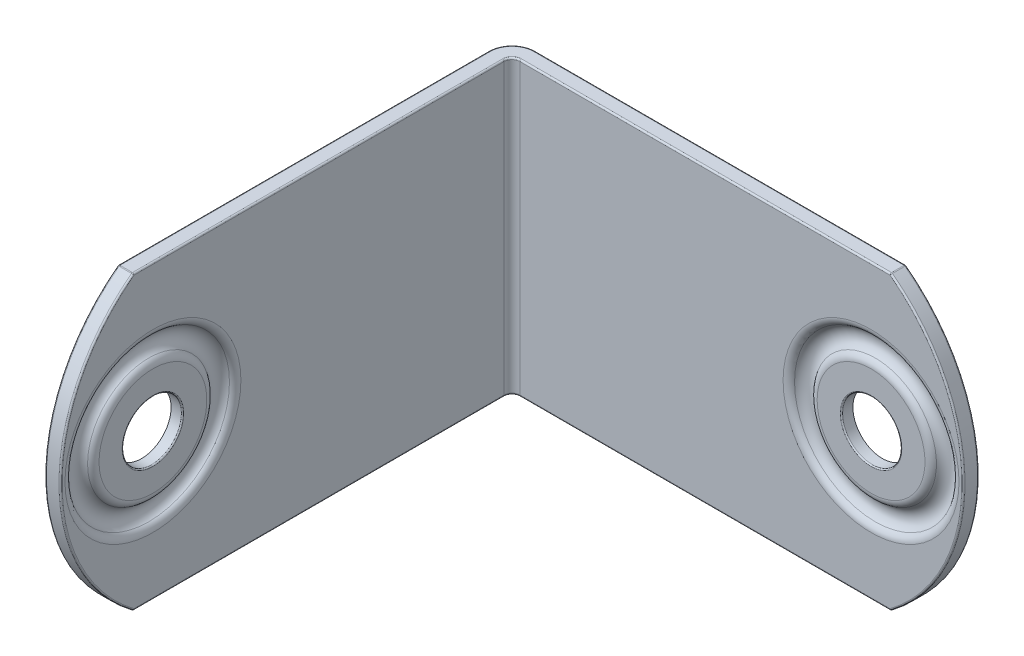
from build123d import *

# Parameters (mm, degrees)
BOSS_EXTRUDE1_START = 11.90625
BOSS_EXTRUDE1_DEPTH = 23.8125
SKETCH4_W           = 1.27
SKETCH4_H           = 2.413
SKETCH5_W           = 2.413
SKETCH5_H           = 1.27
CUT_EXTRUDE1_DEPTH  = 44.140586332
CUT_EXTRUDE2_DEPTH  = 44.140586332
FILLET1_R           = 0.127
FILLET2_R           = 0.09652


with BuildPart() as part:
    # Sketch3 → Boss-Extrude1 (new body)
    with BuildSketch(Plane(origin=(0, 0, 0), x_dir=(1, 0, 0), z_dir=(0, 1, 0)).offset(BOSS_EXTRUDE1_START)):
        with BuildLine():
            Line((-19.05, -19.05), (-17.78, -19.05))
            Line((-17.78, -19.05), (-17.78, 17.145))
            ThreePointArc((-17.78, 17.145), (-17.594012806, 17.594012806), (-17.145, 17.78))
            Line((-17.145, 17.78), (19.05, 17.78))
            Line((19.05, 17.78), (19.05, 19.05))
            Line((19.05, 19.05), (-17.145, 19.05))
            ThreePointArc((-17.145, 19.05), (-18.492038418, 18.492038418), (-19.05, 17.145))
            Line((-19.05, 17.145), (-19.05, -19.05))
        make_face()
    extrude(amount=-BOSS_EXTRUDE1_DEPTH)

    # Sketch4 → Cut-Revolve1 (revolve, cut)
    with BuildSketch(Plane(origin=(0, 0, 0), x_dir=(1, 0, 0), z_dir=(0, 1, 0)), mode=Mode.PRIVATE) as cut_revolve1_sk:
        with Locations((-18.415, -10.302875)):
            Rectangle(SKETCH4_W, SKETCH4_H)
    revolve(cut_revolve1_sk.sketch.rotate(Axis((-19.05, 0, 11.509375), (1, 0, 0)), 180), axis=Axis((-19.05, 0, 11.509375), (1, 0, 0)), mode=Mode.SUBTRACT)

    # Sketch5 → Cut-Revolve2 (revolve, cut)
    with BuildSketch(Plane(origin=(0, 0, 0), x_dir=(1, 0, 0), z_dir=(0, 1, 0)), mode=Mode.PRIVATE) as cut_revolve2_sk:
        with Locations((12.715875, 18.415)):
            Rectangle(SKETCH5_W, SKETCH5_H)
    revolve(cut_revolve2_sk.sketch.rotate(Axis((11.509375, 0, -19.05), (0, 0, 1)), 180), axis=Axis((11.509375, 0, -19.05), (0, 0, 1)), mode=Mode.SUBTRACT)

    # Sketch6 → Cut-Extrude1 (cut, through all)
    with BuildSketch(Plane(origin=(-17.78, 0, 0), x_dir=(0, 0, -1), z_dir=(1, 0, 0))):
        with BuildLine():
            ThreePointArc((-19.05, 0), (-17.478779679, 6.655796089), (-13.096875, 11.90625))
            Line((-13.096875, 11.90625), (-19.05, 11.90625))
            Line((-19.05, 11.90625), (-19.05, 0))
        make_face()
        with BuildLine():
            ThreePointArc((-13.096875, -11.90625), (-17.478779679, -6.655796089), (-19.05, 0))
            Line((-19.05, 0), (-19.05, -11.90625))
            Line((-19.05, -11.90625), (-13.096875, -11.90625))
        make_face()
    extrude(amount=-CUT_EXTRUDE1_DEPTH, mode=Mode.SUBTRACT)

    # Sketch7 → Cut-Extrude2 (cut, through all)
    with BuildSketch(Plane.XY.offset(-17.78)):
        with BuildLine():
            Line((19.05, 11.90625), (13.096875, 11.90625))
            ThreePointArc((13.096875, 11.90625), (17.478779679, 6.655796089), (19.05, 0))
            Line((19.05, 0), (19.05, 11.90625))
        make_face()
        with BuildLine():
            Line((19.05, -11.90625), (19.05, 0))
            ThreePointArc((19.05, 0), (17.478779679, -6.655796089), (13.096875, -11.90625))
            Line((13.096875, -11.90625), (19.05, -11.90625))
        make_face()
    extrude(amount=-CUT_EXTRUDE2_DEPTH, mode=Mode.SUBTRACT)

    # Fillet1
    fillet1_edges = [part.edges().sort_by_distance(p)[0] for p in [
        (-19.05, 11.90625, -2.0240625),
        (-17.594012806, -11.90625, -17.594012806),
        (-2.0240625, -11.90625, -17.78),
        (-18.492038418, -11.90625, -18.492038418),
        (-17.78, 11.90625, -2.0240625),
        (-17.78, 0, 19.05),
        (-18.415, 11.90625, 13.096875),
        (-19.05, 0, 19.05),
        (-19.05, -11.90625, -2.0240625),
        (-17.78, -11.90625, -2.0240625),
        (-18.415, -11.90625, 13.096875),
        (-2.0240625, 11.90625, -19.05),
        (13.096875, 11.90625, -18.415),
        (19.05, 0, -19.05),
        (19.05, 0, -17.78),
        (-2.0240625, -11.90625, -19.05),
        (13.096875, -11.90625, -18.415),
        (-18.492038418, 11.90625, -18.492038418),
        (-2.0240625, 11.90625, -17.78),
        (-17.594012806, 11.90625, -17.594012806),
    ]]
    fillet(fillet1_edges, radius=FILLET1_R)

    # Fillet2
    fillet2_edges = [part.edges().sort_by_distance(p)[0] for p in [
        (-19.05, 0, 9.096375),
        (-17.78, 0, 9.096375),
        (13.922375, 0, -17.78),
        (13.922375, 0, -19.05),
    ]]
    fillet(fillet2_edges, radius=FILLET2_R)

    # Sketch8 → Cut-Revolve3 (revolve, cut)
    with BuildSketch(Plane(origin=(0, 0, 0), x_dir=(1, 0, 0), z_dir=(0, 1, 0)), mode=Mode.PRIVATE) as cut_revolve3_sk:
        with BuildLine():
            Line((-17.78, -4.333875), (-17.78, -7.112))
            ThreePointArc((-17.78, -7.112), (-17.871042371, -6.769174085), (-18.120178571, -6.5166875))
            ThreePointArc((-18.120178571, -6.5166875), (-18.57375, -5.7229375), (-18.120178571, -4.9291875))
            ThreePointArc((-18.120178571, -4.9291875), (-17.871042371, -4.676700915), (-17.78, -4.333875))
        make_face()
        with BuildLine():
            Line((-18.709821429, -7.112), (-18.709821429, -9.096375))
            Line((-18.709821429, -9.096375), (-19.05, -9.096375))
            Line((-19.05, -9.096375), (-19.05, -6.5166875))
            ThreePointArc((-19.05, -6.5166875), (-18.8008638, -6.769174085), (-18.709821429, -7.112))
        make_face()
    revolve(cut_revolve3_sk.sketch.rotate(Axis((-19.05, 0, 11.509375), (1, 0, 0)), 180), axis=Axis((-19.05, 0, 11.509375), (1, 0, 0)), mode=Mode.SUBTRACT)

    # Sketch9 → Revolve1 (revolve)
    with BuildSketch(Plane(origin=(0, 0, 0), x_dir=(1, 0, 0), z_dir=(0, 1, 0))):
        with BuildLine():
            Line((-19.05, -4.9291875), (-19.05, -6.5166875))
            ThreePointArc((-19.05, -6.5166875), (-19.503571429, -5.7229375), (-19.05, -4.9291875))
        make_face()
    revolve(axis=Axis((-19.05, 0, 11.509375), (1, 0, 0)))

    # Sketch10 → Cut-Revolve4 (revolve, cut)
    with BuildSketch(Plane(origin=(0, 0, 0), x_dir=(1, 0, 0), z_dir=(0, 1, 0)), mode=Mode.PRIVATE) as cut_revolve4_sk:
        with BuildLine():
            Line((18.684875, 17.78), (15.90675, 17.78))
            ThreePointArc((15.90675, 17.78), (16.249575915, 17.871042371), (16.5020625, 18.120178571))
            ThreePointArc((16.5020625, 18.120178571), (17.2958125, 18.57375), (18.0895625, 18.120178571))
            ThreePointArc((18.0895625, 18.120178571), (18.342049085, 17.871042371), (18.684875, 17.78))
        make_face()
        with BuildLine():
            Line((15.90675, 18.709821429), (13.922375, 18.709821429))
            Line((13.922375, 18.709821429), (13.922375, 19.05))
            Line((13.922375, 19.05), (16.5020625, 19.05))
            ThreePointArc((16.5020625, 19.05), (16.249575915, 18.8008638), (15.90675, 18.709821429))
        make_face()
    revolve(cut_revolve4_sk.sketch.rotate(Axis((11.509375, 0, -19.05), (0, 0, 1)), 180), axis=Axis((11.509375, 0, -19.05), (0, 0, 1)), mode=Mode.SUBTRACT)

    # Sketch11 → Revolve2 (revolve)
    with BuildSketch(Plane(origin=(0, 0, 0), x_dir=(1, 0, 0), z_dir=(0, 1, 0))):
        with BuildLine():
            Line((16.5020625, 19.05), (18.0895625, 19.05))
            ThreePointArc((18.0895625, 19.05), (17.2958125, 19.503571429), (16.5020625, 19.05))
        make_face()
    revolve(axis=Axis((11.509375, 0, -19.05), (0, 0, 1)))


solid = part.part
